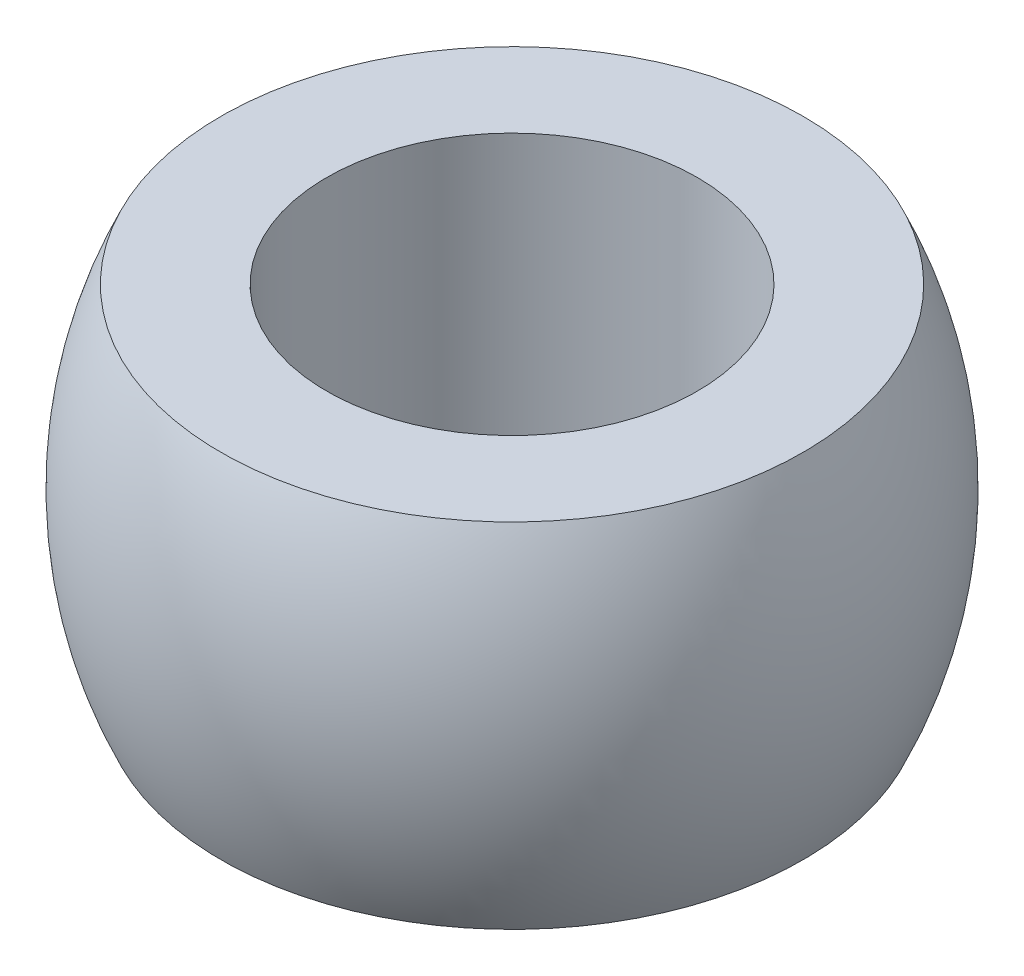
from build123d import *


with BuildPart() as part:
    # Sketch1 → Revolve1 (revolve)
    with BuildSketch(Plane.XY, mode=Mode.PRIVATE) as revolve1_sk:
        with BuildLine():
            Line((-5.25, 10), (-5.25, 0))
            Line((-5.25, 0), (-8.25, 0))
            ThreePointArc((-8.25, 0), (-9.341287885, 5), (-8.25, 10))
            Line((-8.25, 10), (-5.25, 10))
        make_face()
    revolve(revolve1_sk.sketch.rotate(Axis((0, 0, 0), (0, 1, 0)), 270), axis=Axis((0, 0, 0), (0, 1, 0)))


solid = part.part
